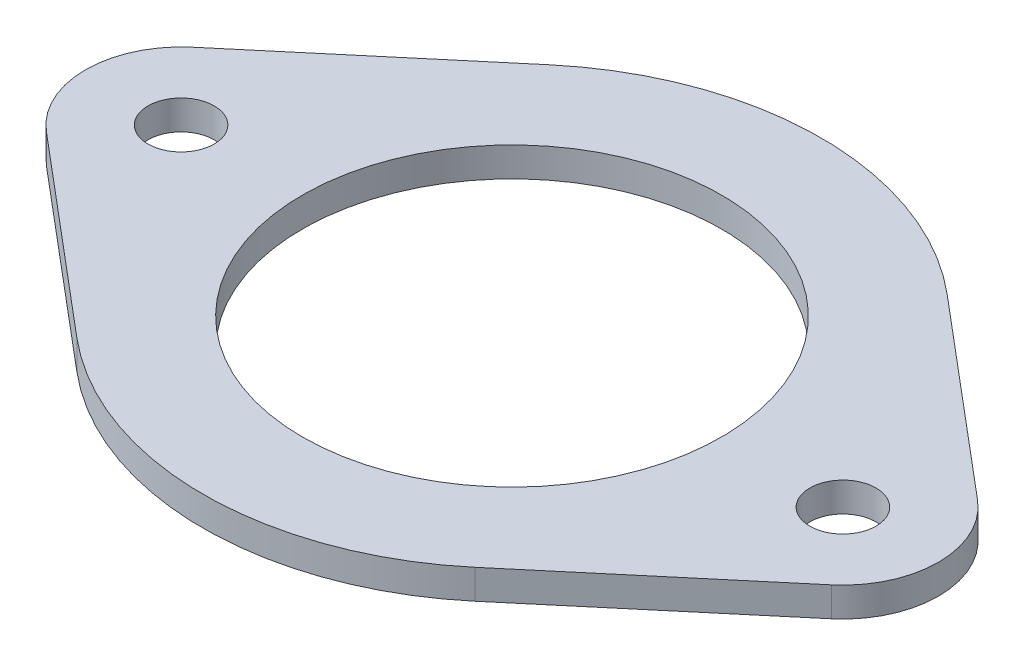
from build123d import *

# Parameters (mm, degrees)
ESQUISSE1_R      = 14.25
ESQUISSE1_R_2    = 2.25
EXTRUSION1_DEPTH = 2


with BuildPart() as part:
    # Esquisse1 → Extrusion1 (new body)
    with BuildSketch(Plane(origin=(0, 0, 0), x_dir=(1, 0, 0), z_dir=(0, 1, 0))):
        with BuildLine():
            Line((13.533333333, 16.057673832), (26.688888889, 4.970232377))
            ThreePointArc((26.688888889, 4.970232377), (29, 0), (26.688888889, -4.970232377))
            Line((26.688888889, -4.970232377), (13.533333333, -16.057673832))
            ThreePointArc((13.533333333, -16.057673832), (0, -21), (-13.533333333, -16.057673832))
            Line((-13.533333333, -16.057673832), (-26.688888889, -4.970232377))
            ThreePointArc((-26.688888889, -4.970232377), (-29, 0), (-26.688888889, 4.970232377))
            Line((-26.688888889, 4.970232377), (-13.533333333, 16.057673832))
            ThreePointArc((-13.533333333, 16.057673832), (0, 21), (13.533333333, 16.057673832))
        make_face()
        Circle(ESQUISSE1_R, mode=Mode.SUBTRACT)
        with Locations((22.5, 0)):
            Circle(ESQUISSE1_R_2, mode=Mode.SUBTRACT)
        with Locations((-22.5, 0)):
            Circle(ESQUISSE1_R_2, mode=Mode.SUBTRACT)
    extrude(amount=EXTRUSION1_DEPTH)


solid = part.part
